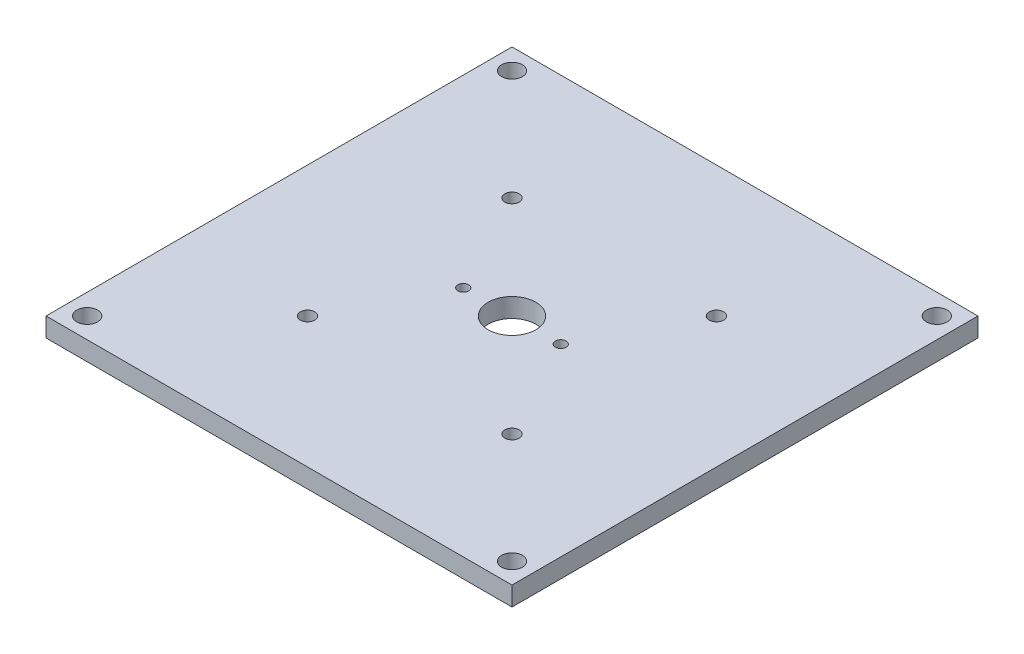
from build123d import *

# Parameters (mm, degrees)
ESQUISSE1_W                   = 155
ESQUISSE1_H                   = 155
BOSS_EXTRU_1_DEPTH            = 6.35
ESQUISSE3_R                   = 3.4417
LAZY_SUSAN_BOLT_PATTERN_DEPTH = 6.35
ESQUISSE4_R                   = 7.9375
ENL_V_MAT_EXTRU_2_DEPTH       = 6.35
D_GAGEMENT_M41_D              = 4.8
D_GAGEMENT_M31_D              = 3.6


with BuildPart() as part:
    # Esquisse1 → Boss.-Extru.1 (new body)
    with BuildSketch(Plane(origin=(0, 0, 0), x_dir=(1, 0, 0), z_dir=(0, 1, 0))):
        Rectangle(ESQUISSE1_W, ESQUISSE1_H)
    extrude(amount=BOSS_EXTRU_1_DEPTH)

    # Esquisse3 → lazy_susan_bolt_pattern (cut)
    with BuildSketch(Plane(origin=(0, 6.35, 0), x_dir=(1, 0, 0), z_dir=(0, 1, 0))):
        with Locations(Location((-70.65, 70.65, 0), (0, 0, 270))):
            Circle(ESQUISSE3_R)
        with Locations(Location((70.65, 70.65, 0), (0, 0, 270))):
            Circle(ESQUISSE3_R)
        with Locations(Location((70.65, -70.65, 0), (0, 0, 270))):
            Circle(ESQUISSE3_R)
        with Locations(Location((-70.65, -70.65, 0), (0, 0, 270))):
            Circle(ESQUISSE3_R)
    extrude(amount=-LAZY_SUSAN_BOLT_PATTERN_DEPTH, mode=Mode.SUBTRACT)

    # Esquisse4 → Enlèv. mat.-Extru.2 (cut)
    with BuildSketch(Plane(origin=(0, 6.35, 0), x_dir=(1, 0, 0), z_dir=(0, 1, 0))):
        with Locations(Location((0, 0, 0), (0, 0, 270))):
            Circle(ESQUISSE4_R)
    extrude(amount=-ENL_V_MAT_EXTRU_2_DEPTH, mode=Mode.SUBTRACT)

    # Dégagement M41 (through all)
    with Locations(Plane(origin=(0, 6.35, 0), x_dir=(1, 0, 0), z_dir=(0, 1, 0))):
        with Locations((-34, 34), (34, 34), (34, -34), (-34, -34)):
            Hole(D_GAGEMENT_M41_D / 2)

    # Dégagement M31 (through all)
    with Locations(Plane(origin=(0, 6.35, 0), x_dir=(1, 0, 0), z_dir=(0, 1, 0))):
        with Locations((16.215, 0), (-16.215, 0)):
            Hole(D_GAGEMENT_M31_D / 2)


solid = part.part
